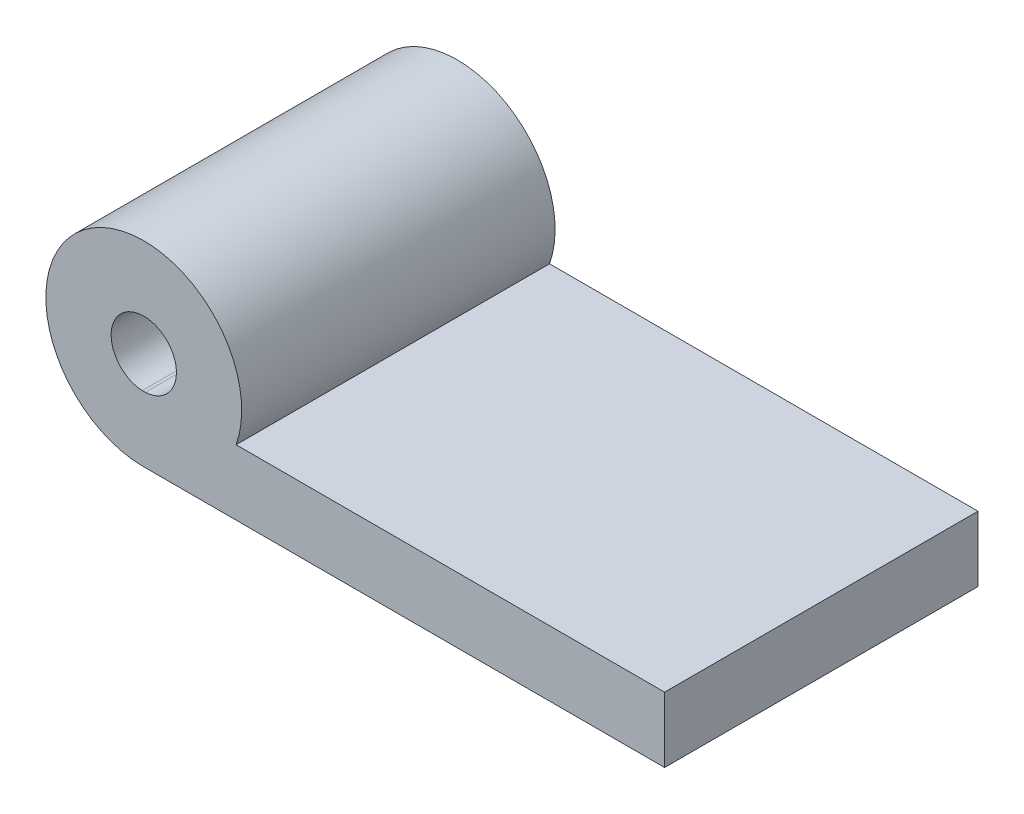
from build123d import *

# Parameters (mm, degrees)
SKETCH1_W           = 25.4
SKETCH1_H           = 15.24
BOSS_EXTRUDE1_DEPTH = 3.175
SKETCH3_R           = 4.761366165
SKETCH3_R_2         = 1.5875
BOSS_EXTRUDE2_DEPTH = 15.24


with BuildPart() as part:
    # Sketch1 → Boss-Extrude1 (new body)
    with BuildSketch(Plane(origin=(0, 0, 0), x_dir=(1, 0, 0), z_dir=(0, 1, 0))):
        with Locations((-33.04393404, -21.504734982)):
            Rectangle(SKETCH1_W, SKETCH1_H)
    extrude(amount=BOSS_EXTRUDE1_DEPTH)

    # Sketch3 → Boss-Extrude2 (add)
    with BuildSketch(Plane.XY.offset(29.124734982)):
        with Locations((-45.670474152, 4.76079945)):
            Circle(SKETCH3_R)
        with Locations((-45.670474152, 4.76079945)):
            Circle(SKETCH3_R_2, mode=Mode.SUBTRACT)
    extrude(amount=-BOSS_EXTRUDE2_DEPTH)


solid = part.part
